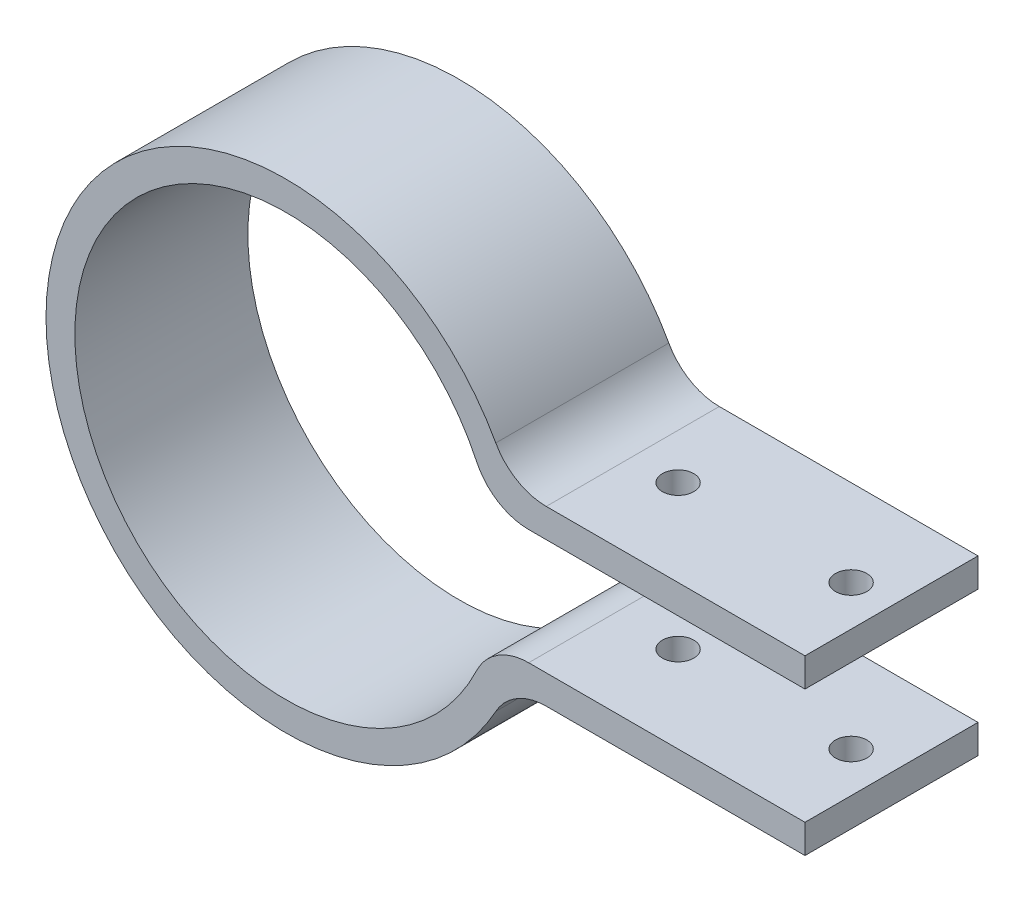
from build123d import *

# Parameters (mm, degrees)
BOSS_EXTRUDE1_DEPTH         = 19.05
FILLET1_R                   = 6.35
F_29_0_136_DIAMETER_HOLE1_D = 3.4544


with BuildPart() as part:
    # Sketch1 → Boss-Extrude1 (new body)
    with BuildSketch(Plane.XY):
        with BuildLine():
            ThreePointArc((22.356689849, -6.35), (-23.241, 0), (22.356689849, 6.35))
            Line((22.356689849, 6.35), (57.15, 6.35))
            Line((57.15, 6.35), (57.15, 9.525))
            Line((57.15, 9.525), (24.638981939, 9.525))
            ThreePointArc((24.638981939, 9.525), (-26.416, 0), (24.638981939, -9.525))
            Line((24.638981939, -9.525), (57.15, -9.525))
            Line((57.15, -9.525), (57.15, -6.35))
            Line((57.15, -6.35), (22.356689849, -6.35))
        make_face()
    extrude(amount=BOSS_EXTRUDE1_DEPTH)

    # Fillet1
    fillet1_edges = [part.edges().sort_by_distance(p)[0] for p in [
        (22.356689849, 6.35, 9.525),
        (22.356689849, -6.35, 9.525),
        (24.638981939, -9.525, 9.525),
        (24.638981939, 9.525, 9.525),
    ]]
    fillet(fillet1_edges, radius=FILLET1_R)

    # #29 (0.136) Diameter Hole1 (through all)
    with Locations(Plane(origin=(0, 9.525, 0), x_dir=(1, 0, 0), z_dir=(0, 1, 0))):
        with Locations((33.655, -9.525), (52.705, -9.525)):
            Hole(F_29_0_136_DIAMETER_HOLE1_D / 2)


solid = part.part
